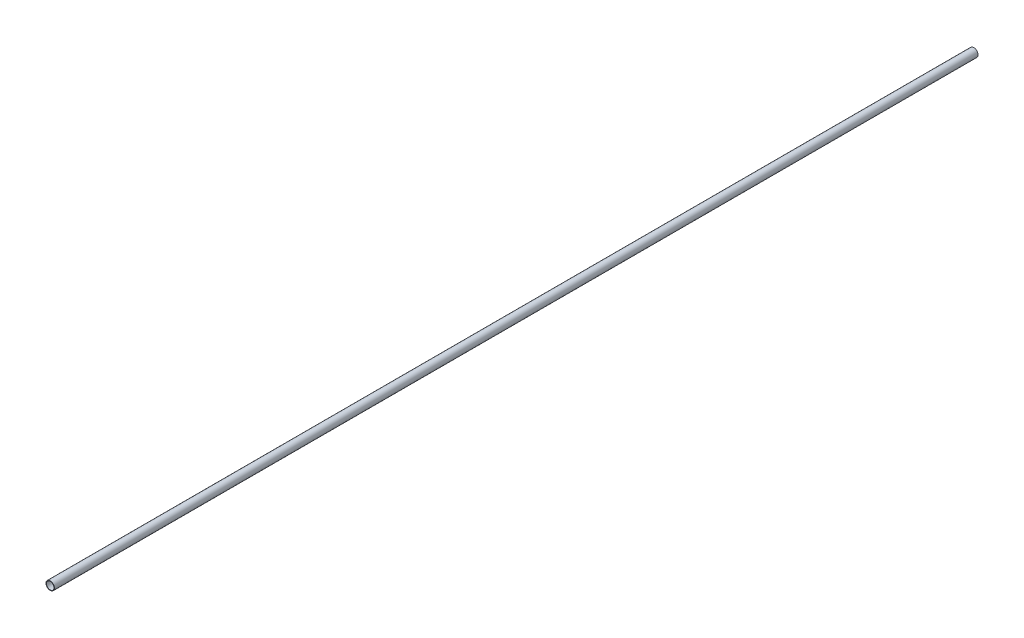
from build123d import *

# Parameters (mm, degrees)
SKETCH1_R           = 11.1
SKETCH1_R_2         = 9.95
BOSS_EXTRUDE1_DEPTH = 2440


with BuildPart() as part:
    # Sketch1 → Boss-Extrude1 (new body)
    with BuildSketch(Plane.XY):
        Circle(SKETCH1_R)
        Circle(SKETCH1_R_2, mode=Mode.SUBTRACT)
    extrude(amount=BOSS_EXTRUDE1_DEPTH)


solid = part.part
